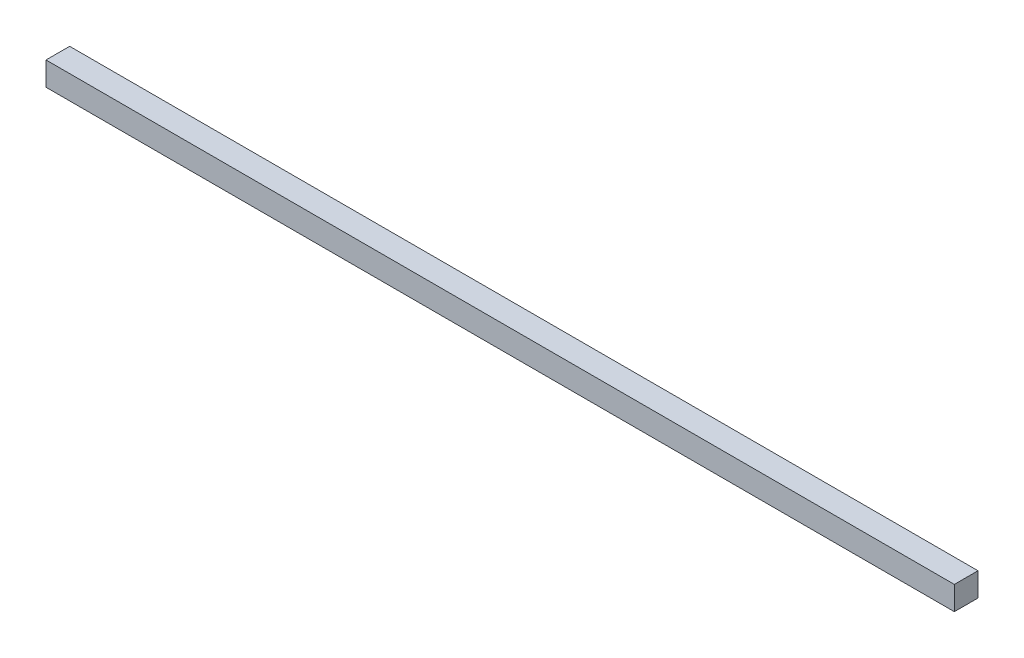
from build123d import *

# Parameters (mm, degrees)
SKETCH1_W           = 384
SKETCH1_H           = 10
BOSS_EXTRUDE1_DEPTH = 5


with BuildPart() as part:
    # Sketch1 → Boss-Extrude1 (new, symmetric)
    with BuildSketch(Plane.XY):
        Rectangle(SKETCH1_W, SKETCH1_H)
    extrude(amount=BOSS_EXTRUDE1_DEPTH, both=True)


solid = part.part
